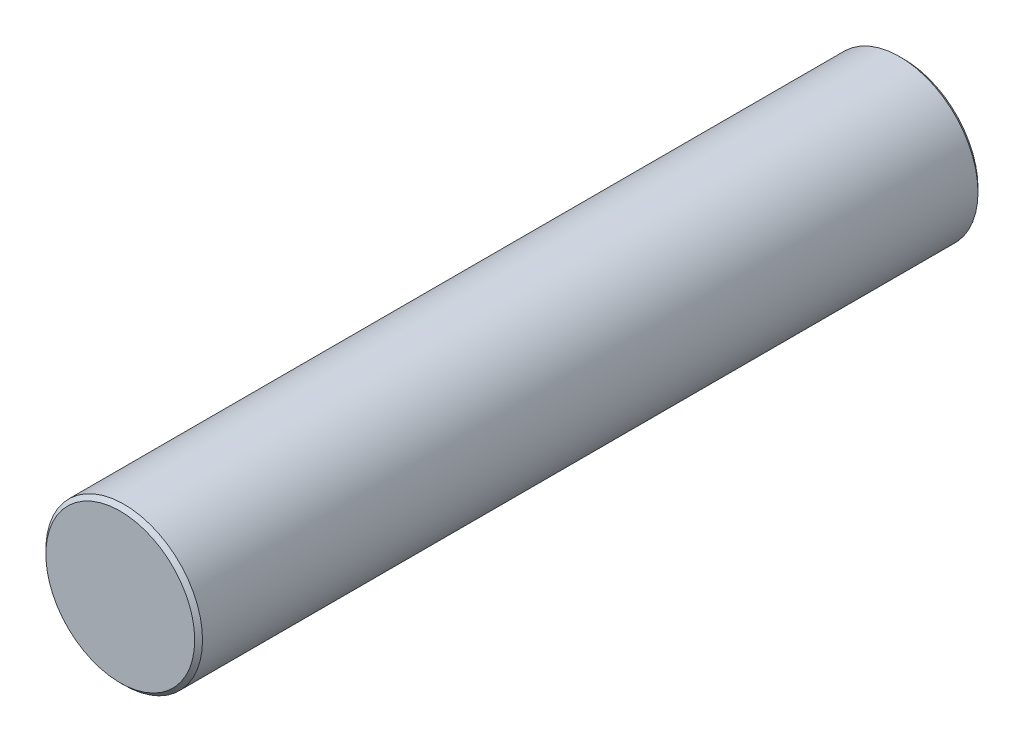
from build123d import *

# Parameters (mm, degrees)
SKETCH_1_R          = 2
EXTRUDE_1_DEPTH     = 20
SKETCH_2_R          = 1
CUT_EXTRUDE_1_DEPTH = 11
CHAMFER_1_SIZE      = 0.1


with BuildPart() as part:
    # 草图1 → 凸台-拉伸1 (new body)
    with BuildSketch(Plane.XY):
        Circle(SKETCH_1_R)
    extrude(amount=EXTRUDE_1_DEPTH)

    # 草图2 → 切除-拉伸1 (cut)
    with BuildSketch(Plane(origin=(0, 0, 0), x_dir=(-1, 0, 0), z_dir=(0, 0, -1))):
        Circle(SKETCH_2_R)
    extrude(amount=-CUT_EXTRUDE_1_DEPTH, mode=Mode.SUBTRACT)

    # 倒角1
    chamfer_1_edges = [part.edges().sort_by_distance(p)[0] for p in [
        (-2, 0, 0),
        (-2, 0, 20),
    ]]
    chamfer(chamfer_1_edges, length=CHAMFER_1_SIZE)


solid = part.part
